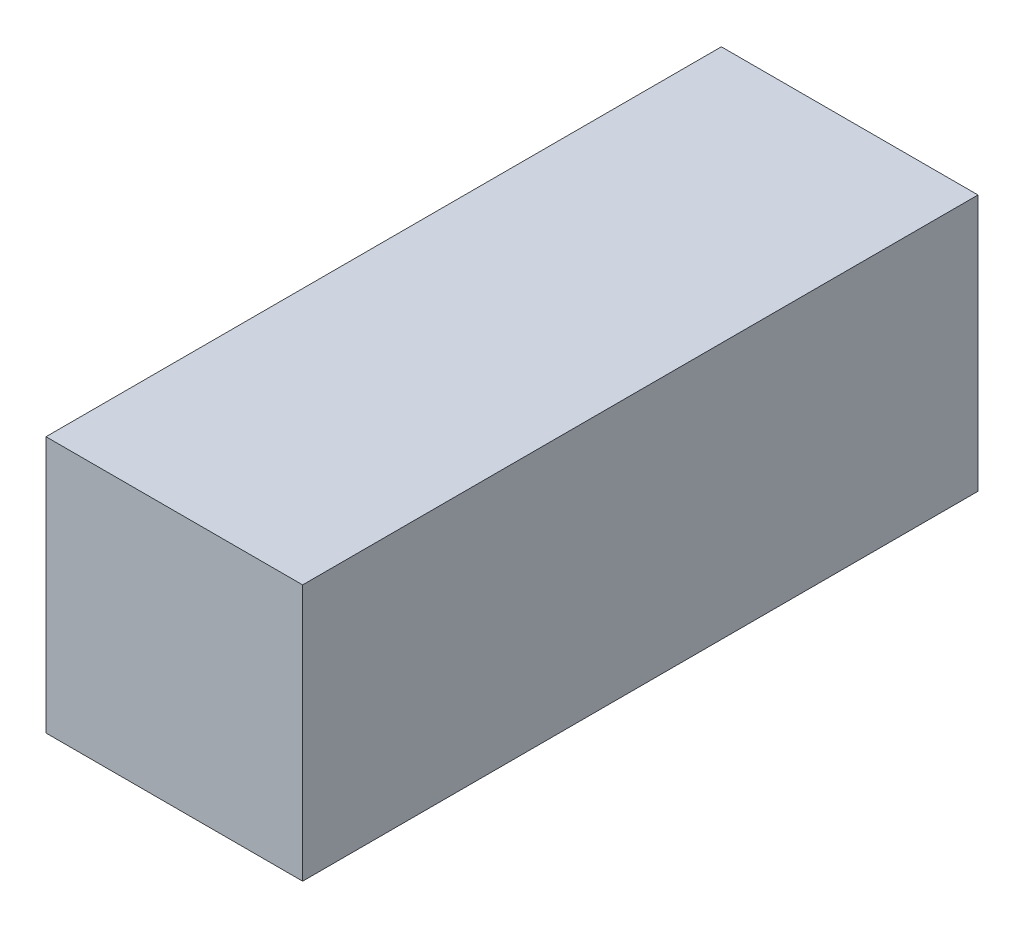
from build123d import *

# Parameters (mm, degrees)
SKETCH_1_W      = 38
SKETCH_1_H      = 38
EXTRUDE_1_DEPTH = 100


with BuildPart() as part:
    # ｽｹｯﾁ1 → ﾎﾞｽ - 押し出し1 (new body)
    with BuildSketch(Plane.XY):
        Rectangle(SKETCH_1_W, SKETCH_1_H)
    extrude(amount=EXTRUDE_1_DEPTH)


solid = part.part
